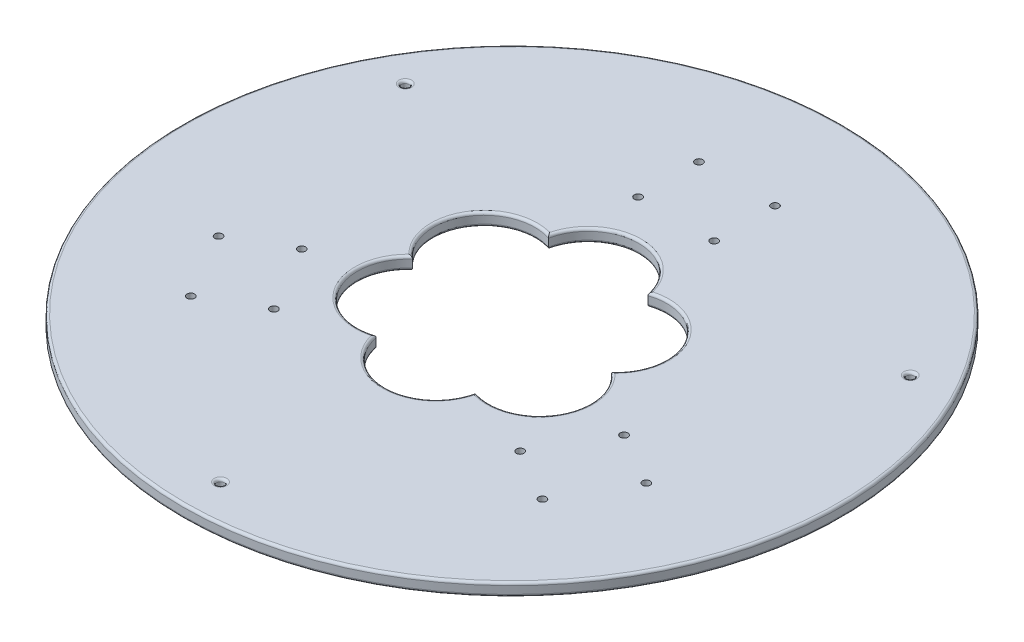
from build123d import *

# Parameters (mm, degrees)
SKETCH1_R           = 130
SKETCH1_R_2         = 1.5
BOSS_EXTRUDE1_DEPTH = 5
FILLET1_R           = 1


with BuildPart() as part:
    # Sketch1 → Boss-Extrude1 (new body)
    with BuildSketch(Plane(origin=(0, 0, 0), x_dir=(1, 0, 0), z_dir=(0, 1, 0))):
        with Locations(Location((0, 0, 0), (0, 0, 270))):
            Circle(SKETCH1_R)
        with Locations(Location((-69.352130745, -57.36097943, 0), (0, 0, 270))):
            Circle(SKETCH1_R_2, mode=Mode.SUBTRACT)
        with Locations(Location((-84.352130745, -31.380217316, 0), (0, 0, 270))):
            Circle(SKETCH1_R_2, mode=Mode.SUBTRACT)
        with Locations(Location((-48.567521054, -45.36097943, 0), (0, 0, 270))):
            Circle(SKETCH1_R_2, mode=Mode.SUBTRACT)
        with Locations(Location((-63.567521054, -19.380217316, 0), (0, 0, 270))):
            Circle(SKETCH1_R_2, mode=Mode.SUBTRACT)
        with Locations(Location((0, -115, 0), (0, 0, 270))):
            Circle(SKETCH1_R_2, mode=Mode.SUBTRACT)
        with Locations(Location((48.567521054, -45.36097943, 0), (0, 0, 270))):
            Circle(SKETCH1_R_2, mode=Mode.SUBTRACT)
        with BuildLine():
            ThreePointArc((19.604759334, -33.956439237), (0, -50), (-19.604759334, -33.956439237))
            ThreePointArc((-19.604759334, -33.956439237), (-43.301270189, -25), (-39.209518669, 0))
            ThreePointArc((-39.209518669, 0), (-43.301270189, 25), (-19.604759334, 33.956439237))
            ThreePointArc((-19.604759334, 33.956439237), (0, 50), (19.604759334, 33.956439237))
            ThreePointArc((19.604759334, 33.956439237), (43.301270189, 25), (39.209518669, 0))
            ThreePointArc((39.209518669, 0), (43.301270189, -25), (19.604759334, -33.956439237))
        make_face(mode=Mode.SUBTRACT)
        with Locations(Location((63.567521054, -19.380217316, 0), (0, 0, 270))):
            Circle(SKETCH1_R_2, mode=Mode.SUBTRACT)
        with Locations(Location((69.352130745, -57.36097943, 0), (0, 0, 270))):
            Circle(SKETCH1_R_2, mode=Mode.SUBTRACT)
        with Locations(Location((84.352130745, -31.380217316, 0), (0, 0, 270))):
            Circle(SKETCH1_R_2, mode=Mode.SUBTRACT)
        with Locations(Location((-99.592921435, 57.5, 0), (0, 0, 270))):
            Circle(SKETCH1_R_2, mode=Mode.SUBTRACT)
        with Locations(Location((-15, 64.741196746, 0), (0, 0, 270))):
            Circle(SKETCH1_R_2, mode=Mode.SUBTRACT)
        with Locations(Location((-15, 88.741196746, 0), (0, 0, 270))):
            Circle(SKETCH1_R_2, mode=Mode.SUBTRACT)
        with Locations(Location((15, 64.741196746, 0), (0, 0, 270))):
            Circle(SKETCH1_R_2, mode=Mode.SUBTRACT)
        with Locations(Location((99.592921435, 57.5, 0), (0, 0, 270))):
            Circle(SKETCH1_R_2, mode=Mode.SUBTRACT)
        with Locations(Location((15, 88.741196746, 0), (0, 0, 270))):
            Circle(SKETCH1_R_2, mode=Mode.SUBTRACT)
    extrude(amount=BOSS_EXTRUDE1_DEPTH)

    # Fillet1
    fillet1_edges = [part.edges().sort_by_distance(p)[0] for p in [
        (-43.301270189, 5, 25),
        (-43.301270189, 5, -25),
        (0, 0, -130),
        (0, 5, -50),
        (-99.592921435, 0, -59),
        (99.592921435, 0, -59),
        (0, 0, 113.5),
        (43.301270189, 5, -25),
        (0, 0, 50),
        (43.301270189, 0, 25),
        (43.301270189, 0, -25),
        (0, 0, -50),
        (-43.301270189, 0, -25),
        (-43.301270189, 0, 25),
        (43.301270189, 5, 25),
        (0, 5, 50),
        (0, 5, 113.5),
        (99.592921435, 5, -59),
        (-99.592921435, 5, -59),
        (0, 5, -130),
    ]]
    fillet(fillet1_edges, radius=FILLET1_R)


solid = part.part
